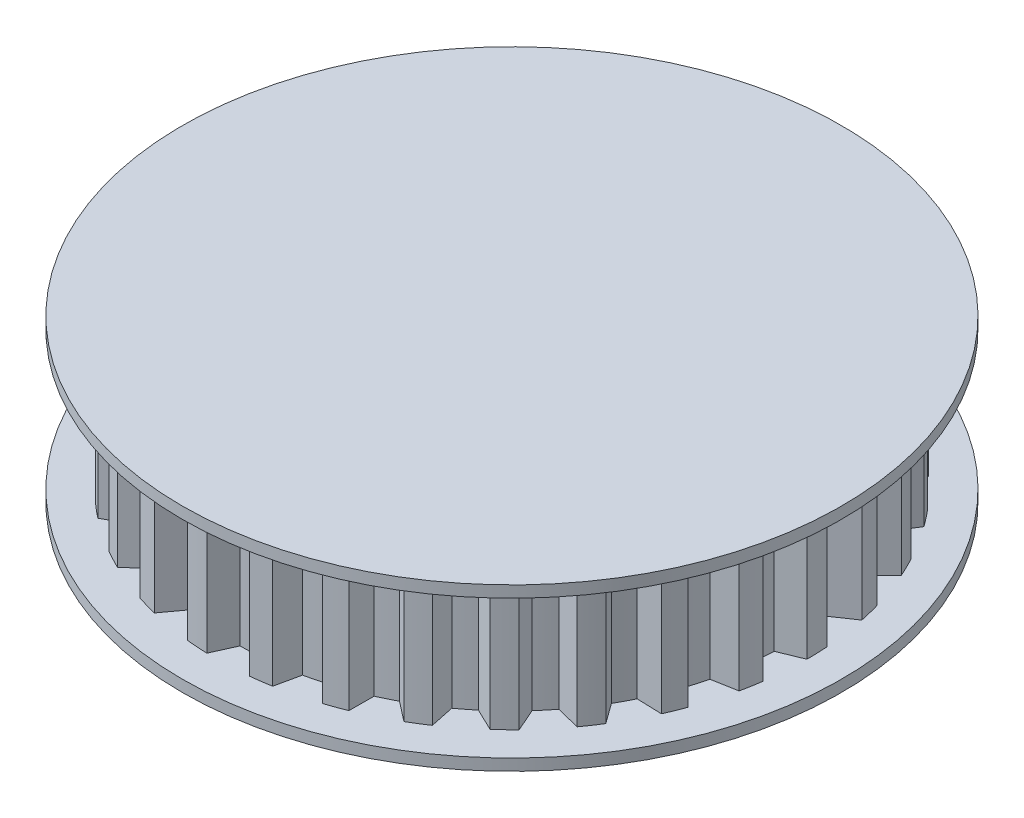
from build123d import *

# Parameters (mm, degrees)
SKETCH1_R           = 28.575
BOSS_EXTRUDE1_DEPTH = 1
BOSS_EXTRUDE3_DEPTH = 12
CIRPATTERN2_COUNT   = 30
SKETCH3_R           = 28.575
BOSS_EXTRUDE4_DEPTH = 1


with BuildPart() as part:
    # Sketch1 → Boss-Extrude1 (new body)
    with BuildSketch(Plane(origin=(0, 0, 0), x_dir=(1, 0, 0), z_dir=(0, 1, 0))):
        with Locations(Location((0, 0, 0), (0, 0, 270))):
            Circle(SKETCH1_R)
    extrude(amount=BOSS_EXTRUDE1_DEPTH)

    # Sketch2 → Boss-Extrude3 (add)
    with BuildSketch(Plane(origin=(0, 1, 0), x_dir=(1, 0, 0), z_dir=(0, 1, 0))):
        with BuildLine():
            Line((0, 0), (25.575, 0))
            ThreePointArc((25.575, 0), (25.559420401, 0.892554628), (25.512700585, 1.784021816))
            Line((25.512700585, 1.784021816), (23.445853683, 2.464258522))
            ThreePointArc((23.445853683, 2.464258522), (23.345569721, 3.281005855), (23.216842777, 4.093755788))
            Line((23.216842777, 4.093755788), (25.016124889, 5.317341493))
            Line((25.016124889, 5.317341493), (0, 0))
        make_face()
    boss_extrude3 = extrude(amount=BOSS_EXTRUDE3_DEPTH)

    # CirPattern2: Boss-Extrude3 ×30 about axis
    cirpattern2_axis = Axis((0, 0, 0), (0, 1, 0))
    for i in range(1, CIRPATTERN2_COUNT):
        add(boss_extrude3.rotate(cirpattern2_axis, i * 360 / CIRPATTERN2_COUNT))

    # Sketch3 → Boss-Extrude4 (add)
    with BuildSketch(Plane(origin=(0, 13, 0), x_dir=(1, 0, 0), z_dir=(0, 1, 0))):
        with Locations(Location((0, 0, 0), (0, 0, 270))):
            Circle(SKETCH3_R)
    extrude(amount=BOSS_EXTRUDE4_DEPTH)


solid = part.part
